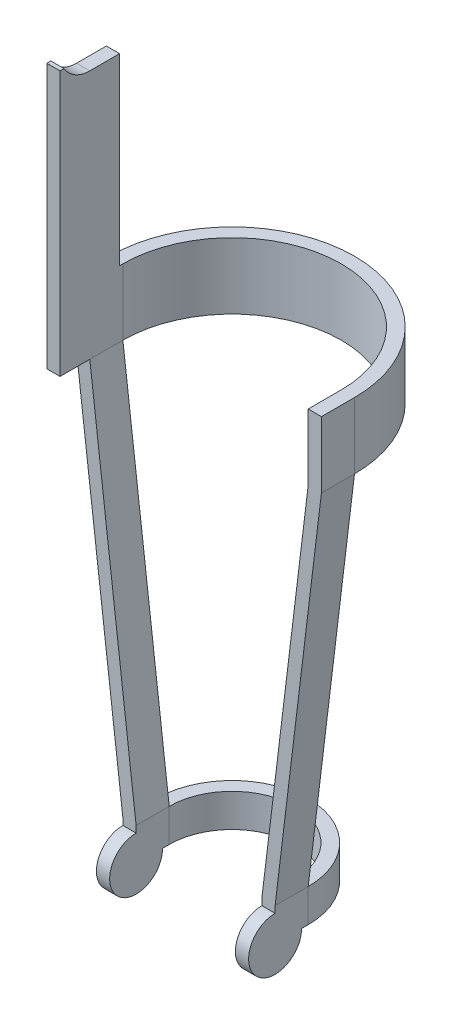
from build123d import *

# Parameters (mm, degrees)
EXTRUDE_1_DEPTH     = 20
SKETCH_3_R          = 16
EXTRUDE_2_DEPTH     = 8
EXTRUDE_START       = -8
SKETCH_4_R          = 16
EXTRUDE_3_DEPTH     = 8
EXTRUDE_4_DEPTH     = 20
SKETCH_5_W          = 8
SKETCH_5_H          = 20
SKETCH_7_W          = 8
SKETCH_7_H          = 20
SKETCH_10_W         = 8
SKETCH_10_H         = 36
EXTRUDE_5_DEPTH     = 160
CUT_EXTRUDE_3_DEPTH = 160


with BuildPart() as part:
    # 草图2 → 凸台-拉伸1 (new body)
    with BuildSketch(Plane(origin=(0, 0, 0), x_dir=(1, 0, 0), z_dir=(0, 1, 0))):
        with BuildLine():
            Line((-46, 0), (-46, -20))
            Line((-46, -20), (-38, -20))
            Line((-38, -20), (-38, 0))
            ThreePointArc((-38, 0), (0, 38), (38, 0))
            Line((38, 0), (38, -20))
            Line((38, -20), (46, -20))
            Line((46, -20), (46, 0))
            ThreePointArc((46, 0), (0, 46), (-46, 0))
        make_face()
    extrude(amount=EXTRUDE_1_DEPTH)

    # 草图3 → 凸台-拉伸2 (add)
    with BuildSketch(Plane.ZY.offset(46)):
        with Locations((20, 0)):
            Circle(SKETCH_3_R)
    extrude(amount=-EXTRUDE_2_DEPTH)

    # 草图4 → 凸台-拉伸3 (add)
    with BuildSketch(Plane(origin=(46, 0, 0), x_dir=(0, 0, -1), z_dir=(1, 0, 0)).offset(EXTRUDE_START)):
        with Locations((-20, 0)):
            Circle(SKETCH_4_R)
    extrude(amount=EXTRUDE_3_DEPTH)



with BuildPart() as body_2:
    # Sketch 3D_1 → 凸台-拉伸4 (new, symmetric)
    with BuildSketch(Plane(origin=(-74, 270, 0), x_dir=(0.9909924304103234, 0, 0.13391789600139506), z_dir=(0, -1, 0))):
        with BuildLine():
            Line((0, 0), (2.67835792, 19.819848608))
            Line((2.67835792, 19.819848608), (10.606297363, 18.74850544))
            Line((10.606297363, 18.74850544), (7.927939443, -1.071343168))
            ThreePointArc((7.927939443, -1.071343168), (64.494858714, -75.315424711), (138.738940257, -18.74850544))
            Line((138.738940257, -18.74850544), (141.417298177, 1.071343168))
            Line((141.417298177, 1.071343168), (149.345237621, 0))
            Line((149.345237621, 0), (146.666879701, -19.819848608))
            ThreePointArc((146.666879701, -19.819848608), (63.423515546, -83.243364154), (0, 0))
        make_face()
    extrude(amount=EXTRUDE_4_DEPTH, both=True)


with BuildPart() as part_1:
    add(part.part)

    add(body_2.part)  # 扫描1 merges body 2
    # 扫描1: sweep along a path in 草图6
    with BuildLine(Plane.XY.offset(20)) as sweep_1_path:
        Line((46, 20), (74, 250))
    # 草图5 → 扫描1 (sweep)
    with BuildSketch(Plane(origin=(0, 20, 0), x_dir=(1, 0, 0), z_dir=(0, 1, 0))):
        with Locations((42, -10)):
            Rectangle(SKETCH_5_W, SKETCH_5_H)
    sweep(path=sweep_1_path.line)

    # 扫描2: sweep along a path in 草图8
    with BuildLine(Plane.XY.offset(20)) as sweep_2_path:
        Line((-46, 20), (-74, 250))
    # 草图7 → 扫描2 (sweep)
    with BuildSketch(Plane(origin=(0, 20, 0), x_dir=(1, 0, 0), z_dir=(0, 1, 0))):
        with Locations((-42, -10)):
            Rectangle(SKETCH_7_W, SKETCH_7_H)
    sweep(path=sweep_2_path.line)

    # 草图10 → 凸台-拉伸5 (add)
    with BuildSketch(Plane.XZ.offset(-250)):
        with Locations((-70, 20)):
            Rectangle(SKETCH_10_W, SKETCH_10_H)
    extrude(amount=-EXTRUDE_5_DEPTH)

    # 草图12 → 切除-拉伸3 (cut)
    with BuildSketch(Plane.ZY.offset(74)):
        with BuildLine():
            Line((20, 401), (2, 401))
            Line((2, 401), (2, 419))
            ThreePointArc((2, 419), (32.727922061, 431.727922061), (20, 401))
        make_face()
    extrude(amount=-CUT_EXTRUDE_3_DEPTH, mode=Mode.SUBTRACT)


solid = part_1.part
